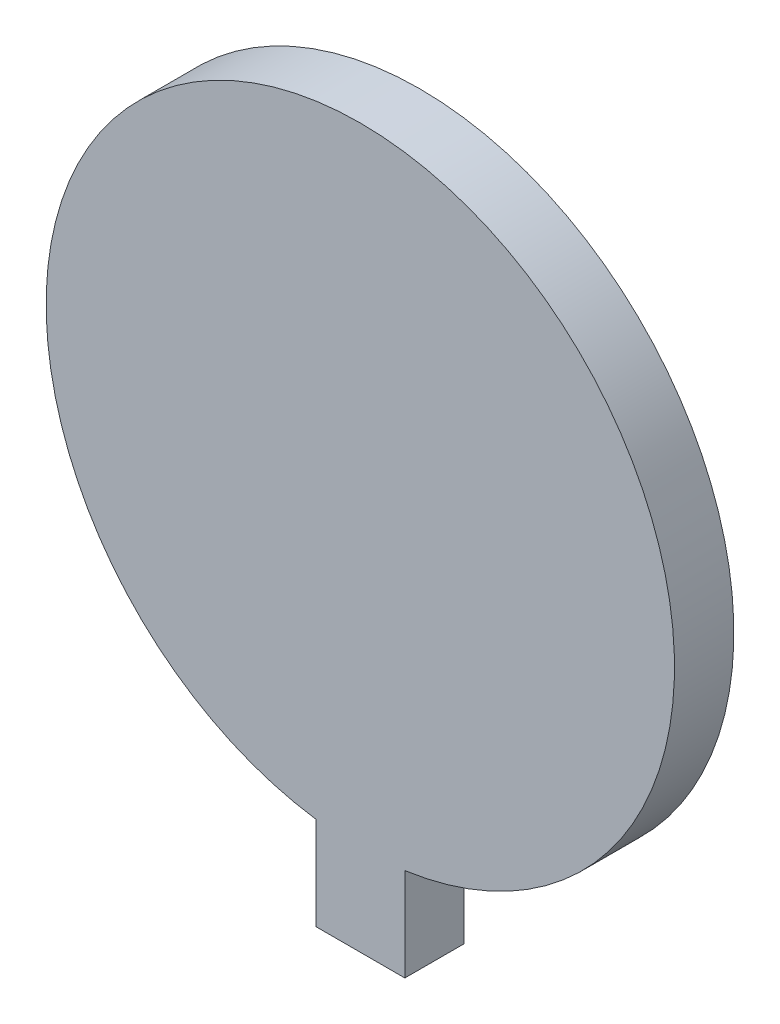
from build123d import *

# Parameters (mm, degrees)
EXTRUDE_1_DEPTH     = 1.2
CUT_EXTRUDE_START   = -1.2
CUT_EXTRUDE_1_DEPTH = 1.2


with BuildPart() as part:
    # Эскиз2 → Бобышка-Вытянуть1 (new body)
    with BuildSketch(Plane.XY):
        with BuildLine():
            Line((-1.6, -5.958019808), (-1.6, -7.958019808))
            Line((-1.6, -7.958019808), (1.6, -7.958019808))
            Line((1.6, -7.958019808), (1.6, -5.958019808))
            ThreePointArc((1.6, -5.958019808), (0, 7.958019808), (-1.6, -5.958019808))
        make_face()
    extrude(amount=EXTRUDE_1_DEPTH)

    # Эскиз3 → Вырез-Вытянуть-Тонкостенный1 (cut)
    with BuildSketch(Plane.XY.offset(1.2).offset(CUT_EXTRUDE_START)):
        with BuildLine():
            Line((-1.6, -5.958019808), (-1.6, -7.958019808))
            Line((-1.6, -7.958019808), (1.6, -7.958019808))
            Line((1.6, -7.958019808), (1.6, -5.958019808))
            ThreePointArc((1.6, -5.958019808), (0, 7.958019808), (-1.6, -5.958019808))
        make_face()
        with BuildLine():
            Line((-0.9, -5.377877105), (-0.9, -7.258019808))
            Line((-0.9, -7.258019808), (0.9, -7.258019808))
            Line((0.9, -7.258019808), (0.9, -5.377877105))
            ThreePointArc((0.9, -5.377877105), (0, 7.258019808), (-0.9, -5.377877105))
        make_face(mode=Mode.SUBTRACT)
    extrude(amount=CUT_EXTRUDE_1_DEPTH, mode=Mode.SUBTRACT)


solid = part.part
